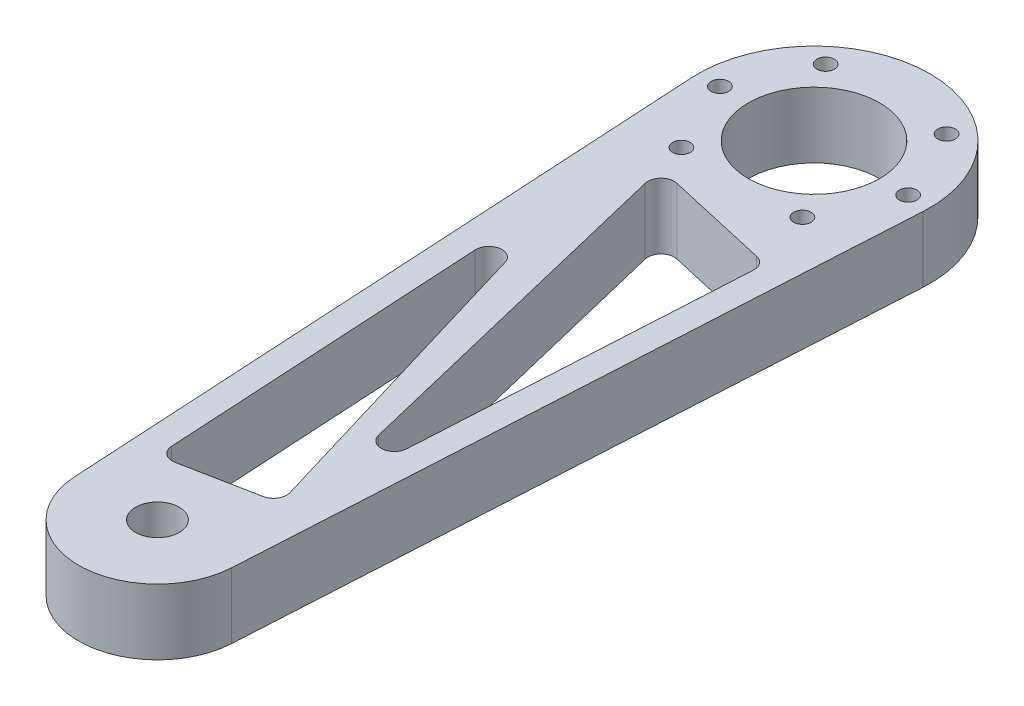
from build123d import *

# Parameters (mm, degrees)
SKETCH_1_R               = 5
SKETCH_1_R_2             = 15
EXTRUDE_1_DEPTH          = 15
FILLET_1_R               = 3
SKETCH_2_R               = 2
CUT_EXTRUDE_1_DEPTH      = 180.107509614
PATTERN_CIRCULAR_3_COUNT = 2
PATTERN_CIRCULAR_3_ANGLE = 50
PATTERN_CIRCULAR_4_COUNT = 2
PATTERN_CIRCULAR_4_ANGLE = 50


with BuildPart() as part:
    # 草图1 → 凸台-拉伸1 (new body)
    with BuildSketch(Plane(origin=(0, 0, 0), x_dir=(1, 0, 0), z_dir=(0, 1, 0))):
        with BuildLine():
            Line((-17.971076762, -1.02), (-26.457418567, 148.498333333))
            ThreePointArc((-26.457418567, 148.498333333), (0, 176.5), (26.457418567, 148.498333333))
            Line((26.457418567, 148.498333333), (17.971076762, -1.02))
            ThreePointArc((17.971076762, -1.02), (0, -18), (-17.971076762, -1.02))
        make_face()
        with Locations(Location((0, 0, 0), (0, 0, 270))):
            Circle(SKETCH_1_R, mode=Mode.SUBTRACT)
        with Locations(Location((0, 150, 0), (0, 0, 270))):
            Circle(SKETCH_1_R_2, mode=Mode.SUBTRACT)
        Polygon((-12.740980954, 12.714849757), (-18.554385191, 115.139490738), (10.712851955, 17.329399023), align=None, mode=Mode.SUBTRACT)
        Polygon((13.283215706, 22.268322657), (18.830257334, 120), (-12, 127), align=None, mode=Mode.SUBTRACT)
    extrude(amount=EXTRUDE_1_DEPTH)

    # 圆角1
    fillet_1_edges = [part.edges().sort_by_distance(p)[0] for p in [
        (-12.740980954, 7.5, -12.714849757),
        (10.712851955, 7.5, -17.329399023),
        (-18.554385191, 7.5, -115.139490738),
        (18.830257334, 7.5, -120),
        (-12, 7.5, -127),
        (13.283215706, 7.5, -22.268322657),
    ]]
    fillet(fillet_1_edges, radius=FILLET_1_R)

    # 草图2 → 切除-拉伸1 (cut, through all)
    with BuildSketch(Plane(origin=(0, 15, 0), x_dir=(1, 0, 0), z_dir=(0, 1, 0))):
        with Locations(Location((-21.5, 150, 0), (0, 0, 270))):
            Circle(SKETCH_2_R)
        with Locations(Location((21.5, 150, 0), (0, 0, 270))):
            Circle(SKETCH_2_R)
    cut_extrude_1 = extrude(amount=-CUT_EXTRUDE_1_DEPTH, mode=Mode.SUBTRACT)

    # 阵列(圆周)3: 切除-拉伸1 ×2 about axis
    pattern_circular_3_axis = Axis((0, 0, -150), (0, 1, 0))
    for i in range(1, PATTERN_CIRCULAR_3_COUNT):
        add(cut_extrude_1.rotate(pattern_circular_3_axis, i * PATTERN_CIRCULAR_3_ANGLE / (PATTERN_CIRCULAR_3_COUNT - 1)), mode=Mode.SUBTRACT)

    # 阵列(圆周)4: 切除-拉伸1 ×2 about axis
    pattern_circular_4_axis = Axis((0, 0, -150), (0, -1, 0))
    for i in range(1, PATTERN_CIRCULAR_4_COUNT):
        add(cut_extrude_1.rotate(pattern_circular_4_axis, i * PATTERN_CIRCULAR_4_ANGLE / (PATTERN_CIRCULAR_4_COUNT - 1)), mode=Mode.SUBTRACT)


solid = part.part
